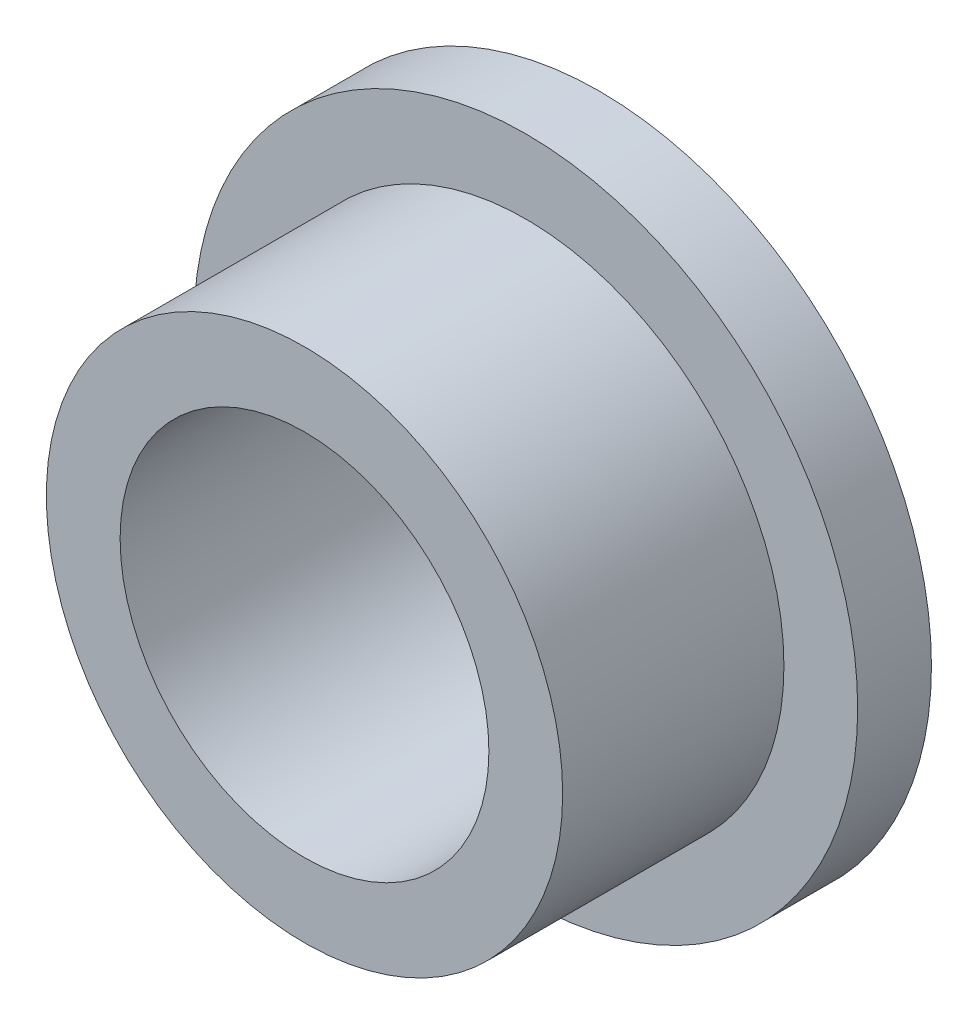
from build123d import *

# Parameters (mm, degrees)
SKETCH1_R           = 7.14375
SKETCH1_R_2         = 3.96875
BOSS_EXTRUDE1_DEPTH = 6.35
CUT_EXTRUDE2_START  = -4.7625
SKETCH2_R           = 7.14375
SKETCH2_R_2         = 5.55625
CUT_EXTRUDE2_DEPTH  = 4.7625


with BuildPart() as part:
    # Sketch1 → Boss-Extrude1 (new body)
    with BuildSketch(Plane.XY):
        Circle(SKETCH1_R)
        Circle(SKETCH1_R_2, mode=Mode.SUBTRACT)
    extrude(amount=BOSS_EXTRUDE1_DEPTH)

    # Sketch2 → Cut-Extrude2 (cut)
    with BuildSketch(Plane.XY.offset(6.35).offset(CUT_EXTRUDE2_START)):
        Circle(SKETCH2_R)
        Circle(SKETCH2_R_2, mode=Mode.SUBTRACT)
    extrude(amount=CUT_EXTRUDE2_DEPTH, mode=Mode.SUBTRACT)


solid = part.part
